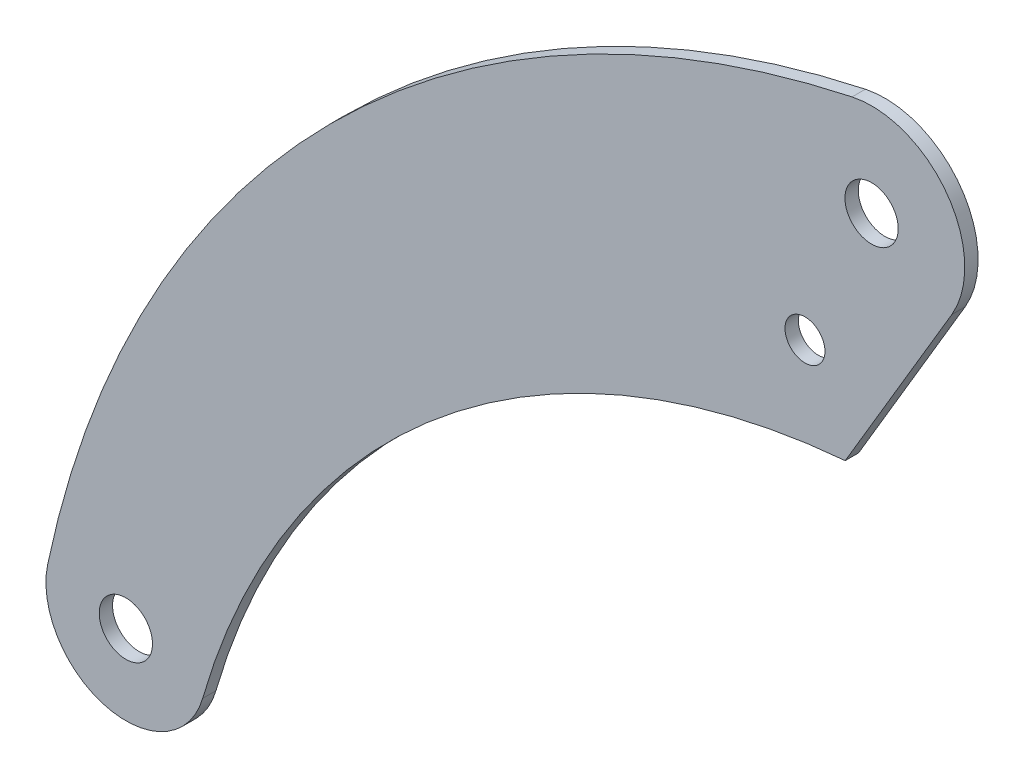
from build123d import *

# Parameters (mm, degrees)
SKETCH1_R           = 20
SKETCH1_R_2         = 15
BOSS_EXTRUDE1_DEPTH = 5


with BuildPart() as part:
    # Sketch1 → Boss-Extrude1 (new, symmetric)
    with BuildSketch(Plane.XY):
        with BuildLine():
            Line((60.220407354, -35.686167321), (-19.779592646, -170.686167321))
            ThreePointArc((-19.779592646, -170.686167321), (-322.664914871, -293.556077803), (-502.341900983, -566.599506551))
            ThreePointArc((-502.341900983, -566.599506551), (-574.483190404, -608.225743411), (-618.715737076, -537.652440745))
            ThreePointArc((-618.715737076, -537.652440745), (-406.524759245, -145.05016338), (-14.634584071, 68.45311497))
            ThreePointArc((-14.634584071, 68.45311497), (56.839813073, 40.856280421), (60.220407354, -35.686167321))
        make_face()
        Circle(SKETCH1_R, mode=Mode.SUBTRACT)
        with Locations((-50, -107.266816038)):
            Circle(SKETCH1_R_2, mode=Mode.SUBTRACT)
        with Locations((-560, -550)):
            Circle(SKETCH1_R, mode=Mode.SUBTRACT)
    extrude(amount=BOSS_EXTRUDE1_DEPTH, both=True)


solid = part.part
